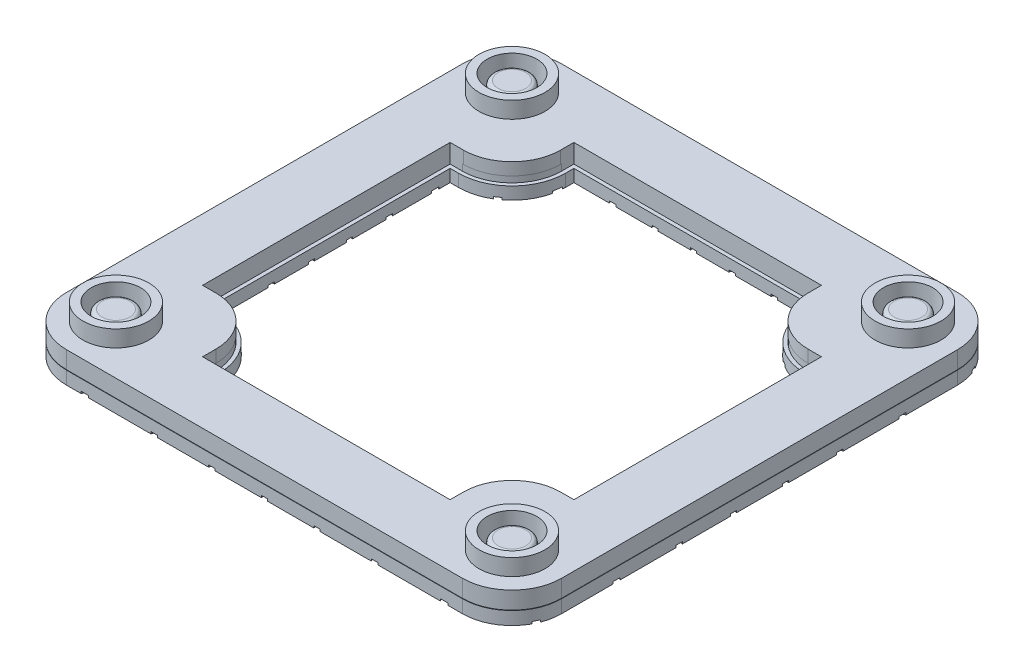
from build123d import *

# Parameters (mm, degrees)
SKETCH1_W                 = 240
SKETCH1_H                 = 240
BOSS_EXTRUDE1_DEPTH       = 12
FILLET2_R                 = 24
SKETCH3_4_R               = 8.7
BOSS_EXTRUDE2_DEPTH       = 5
CUT_EXTRUDE2_START        = -6
SKETCH3_R                 = 12
SKETCH3_R_2               = 8.7
CUT_EXTRUDE2_DEPTH        = 6
SKETCH4_W                 = 120
SKETCH4_H                 = 120
SKETCH4_H_2               = 60
SKETCH4_W_2               = 60
CUT_EXTRUDE3_DEPTH        = 6
FILLET6_R                 = 24
CUT_EXTRUDE4_DEPTH        = 6
SKETCH6_W                 = 120
SKETCH6_H                 = 180
CUT_EXTRUDE5_DEPTH        = 10
SKETCH8_W                 = 180
SKETCH8_H                 = 120
CUT_EXTRUDE6_DEPTH        = 20
FILLET7_R                 = 23.5
BOSS_EXTRUDE4_DEPTH       = 6
BOSS_EXTRUDE5_DEPTH       = 6
BOSS_EXTRUDE6_DEPTH       = 6
BOSS_EXTRUDE7_DEPTH       = 6
FILLET8_R                 = 2
SKETCH16_R                = 16
SKETCH16_R_2              = 12
BOSS_EXTRUDE10_DEPTH      = 8
SKETCH17_R                = 16
SKETCH17_R_2              = 12
BOSS_EXTRUDE11_DEPTH      = 8
SKETCH18_R                = 16
SKETCH18_R_2              = 12
BOSS_EXTRUDE12_DEPTH      = 8
BOSS_EXTRUDE13_DEPTH      = 0.0001
BOSS_EXTRUDE13_DEPTH_BACK = 6
SKETCH19_W                = 168
SKETCH19_H                = 30
SKETCH19_W_2              = 30
SKETCH19_H_2              = 168
CUT_EXTRUDE8_DEPTH        = 10
CUT_EXTRUDE8_DEPTH_BACK   = 0.1
SKETCH20_W                = 322.983229366
SKETCH20_H                = 303.266229899
BOSS_EXTRUDE14_DEPTH      = 3
BOSS_EXTRUDE15_DEPTH      = 3
CUT_EXTRUDE10_START       = -1
SKETCH24_W                = 3
SKETCH24_H                = 32
CUT_EXTRUDE10_DEPTH       = 1
CHAMFER1_SIZE             = 3.5
BOSS_EXTRUDE17_START      = 3.3
BOSS_EXTRUDE17_DEPTH      = 3.3
CHAMFER2_SIZE             = 3.2


with BuildPart() as part:
    # Sketch1 → Boss-Extrude1 (new body)
    with BuildSketch(Plane(origin=(0, 0, 0), x_dir=(1, 0, 0), z_dir=(0, 1, 0))):
        with Locations((120, 120)):
            Rectangle(SKETCH1_W, SKETCH1_H)
    extrude(amount=BOSS_EXTRUDE1_DEPTH)

    # Fillet2
    fillet2_edges = [part.edges().sort_by_distance(p)[0] for p in [
        (0, 6, -240),
        (240, 6, -240),
        (240, 6, 0),
        (0, 6, 0),
    ]]
    fillet(fillet2_edges, radius=FILLET2_R)

    # Sketch3<4> → Boss-Extrude2 (add)
    with BuildSketch(Plane(origin=(0, 12, 0), x_dir=(1, 0, 0), z_dir=(0, 1, 0))):
        with Locations(Location((24, 216, 0), (0, 0, 90))):
            Circle(SKETCH3_4_R)
        with Locations(Location((216, 216, 0), (0, 0, 90))):
            Circle(SKETCH3_4_R)
        with Locations(Location((216, 24, 0), (0, 0, 90))):
            Circle(SKETCH3_4_R)
        with Locations(Location((24, 24, 0), (0, 0, 90))):
            Circle(SKETCH3_4_R)
    extrude(amount=BOSS_EXTRUDE2_DEPTH)

    # Sketch3 → Cut-Extrude2 (cut)
    # profile 1 of 4: a face of its own
    with BuildSketch(Plane(origin=(0, 12, 0), x_dir=(1, 0, 0), z_dir=(0, 1, 0)).offset(CUT_EXTRUDE2_START)):
        with Locations(Location((24, 24, 0), (0, 0, 270))):
            Circle(SKETCH3_R)
        with Locations(Location((24, 24, 0), (0, 0, 270))):
            Circle(SKETCH3_R_2, mode=Mode.SUBTRACT)
    # profile 2 of 4: a face of its own
    with BuildSketch(Plane(origin=(0, 12, 0), x_dir=(1, 0, 0), z_dir=(0, 1, 0)).offset(CUT_EXTRUDE2_START)):
        with Locations(Location((216, 24, 0), (0, 0, 270))):
            Circle(SKETCH3_R)
        with Locations(Location((216, 24, 0), (0, 0, 270))):
            Circle(SKETCH3_R_2, mode=Mode.SUBTRACT)
    # profile 3 of 4: a face of its own
    with BuildSketch(Plane(origin=(0, 12, 0), x_dir=(1, 0, 0), z_dir=(0, 1, 0)).offset(CUT_EXTRUDE2_START)):
        with Locations(Location((216, 216, 0), (0, 0, 270))):
            Circle(SKETCH3_R)
        with Locations(Location((216, 216, 0), (0, 0, 270))):
            Circle(SKETCH3_R_2, mode=Mode.SUBTRACT)
    # profile 4 of 4: a face of its own
    with BuildSketch(Plane(origin=(0, 12, 0), x_dir=(1, 0, 0), z_dir=(0, 1, 0)).offset(CUT_EXTRUDE2_START)):
        with Locations(Location((24, 216, 0), (0, 0, 270))):
            Circle(SKETCH3_R)
        with Locations(Location((24, 216, 0), (0, 0, 270))):
            Circle(SKETCH3_R_2, mode=Mode.SUBTRACT)
    extrude(amount=CUT_EXTRUDE2_DEPTH, mode=Mode.SUBTRACT)

    # Sketch4 → Cut-Extrude3 (cut)
    with BuildSketch(Plane.XZ):
        with Locations((120, -120)):
            Rectangle(SKETCH4_W, SKETCH4_H)
        with Locations((120, -210)):
            Rectangle(SKETCH4_W, SKETCH4_H_2)
        with Locations((30, -120)):
            Rectangle(SKETCH4_W_2, SKETCH4_H)
        with Locations((120, -30)):
            Rectangle(SKETCH4_W, SKETCH4_H_2)
        with Locations((210, -120)):
            Rectangle(SKETCH4_W_2, SKETCH4_H)
    extrude(amount=-CUT_EXTRUDE3_DEPTH, mode=Mode.SUBTRACT)

    # Fillet6
    fillet6_edges = [part.edges().sort_by_distance(p)[0] for p in [
        (180, 3, -60),
        (240, 3, -60),
        (240, 3, -180),
        (180, 3, -180),
        (180, 3, -240),
        (60, 3, -240),
        (60, 3, -180),
        (0, 3, -180),
        (0, 3, -60),
        (60, 3, -60),
        (60, 3, 0),
        (180, 3, 0),
    ]]
    fillet(fillet6_edges, radius=FILLET6_R)

    # Sketch5 → Cut-Extrude4 (cut)
    with BuildSketch(Plane(origin=(0, 6, 0), x_dir=(-1, 0, 0), z_dir=(0, -1, 0))):
        Polygon((-180, 30), (-60, 30), (-120, 80), align=None)
        Polygon((-60, 210), (-120, 160), (-180, 210), align=None)
        Polygon((-210, 120), (-160, 120), (-210, 180), align=None)
        Polygon((-210, 60), (-160, 120), (-210, 120), align=None)
        Polygon((-80, 120), (-30, 60), (-30, 120), align=None)
        Polygon((-80, 120), (-30, 120), (-30, 180), align=None)
        with BuildLine():
            ThreePointArc((-145, 120), (-120, 95), (-95, 120))
            Line((-95, 120), (-145, 120))
        make_face()
        with BuildLine():
            Line((-145, 120), (-95, 120))
            ThreePointArc((-95, 120), (-120, 145), (-145, 120))
        make_face()
    extrude(amount=-CUT_EXTRUDE4_DEPTH, mode=Mode.SUBTRACT)

    # Sketch6 → Cut-Extrude5 (cut)
    with BuildSketch(Plane(origin=(0, 12, 0), x_dir=(1, 0, 0), z_dir=(0, 1, 0))):
        with Locations((120, 120)):
            Rectangle(SKETCH6_W, SKETCH6_H)
    extrude(amount=-CUT_EXTRUDE5_DEPTH, mode=Mode.SUBTRACT)

    # Sketch8 → Cut-Extrude6 (cut)
    with BuildSketch(Plane(origin=(0, 12, 0), x_dir=(1, 0, 0), z_dir=(0, 1, 0))):
        with Locations((120, 120)):
            Rectangle(SKETCH8_W, SKETCH8_H)
    extrude(amount=-CUT_EXTRUDE6_DEPTH, mode=Mode.SUBTRACT)

    # Fillet7
    fillet7_edges = [part.edges().sort_by_distance(p)[0] for p in [
        (60, 9, -180),
        (180, 9, -180),
        (60, 9, -60),
        (180, 9, -60),
    ]]
    fillet(fillet7_edges, radius=FILLET7_R)

    # Sketch9 → Boss-Extrude4 (add)
    with BuildSketch(Plane.XZ.offset(-6)):
        with BuildLine():
            Line((146.986153835, -210), (96.986153835, -210))
            ThreePointArc((96.986153835, -210), (81.986153835, -225), (96.986153835, -240))
            Line((96.986153835, -240), (146.986153835, -240))
            ThreePointArc((146.986153835, -240), (161.986153835, -225), (146.986153835, -210))
        make_face()
    extrude(amount=BOSS_EXTRUDE4_DEPTH)

    # Sketch10 → Boss-Extrude5 (add)
    with BuildSketch(Plane.XZ.offset(-6)):
        with BuildLine():
            ThreePointArc((240, -95), (225, -80), (210, -95))
            Line((210, -95), (210, -145))
            ThreePointArc((210, -145), (225, -160), (240, -145))
            Line((240, -145), (240, -95))
        make_face()
    extrude(amount=BOSS_EXTRUDE5_DEPTH)

    # Sketch11 → Boss-Extrude6 (add)
    with BuildSketch(Plane.XZ.offset(-6)):
        with BuildLine():
            Line((145, 0), (95, 0))
            ThreePointArc((95, 0), (80, -15), (95, -30))
            Line((95, -30), (145, -30))
            ThreePointArc((145, -30), (160, -15), (145, 0))
        make_face()
    extrude(amount=BOSS_EXTRUDE6_DEPTH)

    # Sketch12 → Boss-Extrude7 (add)
    with BuildSketch(Plane.XZ.offset(-6)):
        with BuildLine():
            ThreePointArc((30, -95), (15, -80), (0, -95))
            Line((0, -95), (0, -145))
            ThreePointArc((0, -145), (15, -160), (30, -145))
            Line((30, -145), (30, -95))
        make_face()
    extrude(amount=BOSS_EXTRUDE7_DEPTH)

    # Fillet8
    fillet8_edges = [part.edges().sort_by_distance(p)[0] for p in [
        (24, 17, -207.3),
        (216, 17, -207.3),
        (216, 17, -15.3),
        (24, 17, -15.3),
    ]]
    fillet(fillet8_edges, radius=FILLET8_R)

    # Sketch16 → Boss-Extrude10 (add)
    with BuildSketch(Plane(origin=(0, 12, 0), x_dir=(1, 0, 0), z_dir=(0, 1, 0))):
        with Locations(Location((24, 216, 0), (0, 0, 90))):
            Circle(SKETCH16_R)
        with Locations(Location((24, 216, 0), (0, 0, 270))):
            Circle(SKETCH16_R_2, mode=Mode.SUBTRACT)
    extrude(amount=BOSS_EXTRUDE10_DEPTH)

    # Sketch17 → Boss-Extrude11 (add)
    with BuildSketch(Plane(origin=(0, 12, 0), x_dir=(1, 0, 0), z_dir=(0, 1, 0))):
        with Locations(Location((24, 24, 0), (0, 0, 90))):
            Circle(SKETCH17_R)
        with Locations(Location((24, 24, 0), (0, 0, 270))):
            Circle(SKETCH17_R_2, mode=Mode.SUBTRACT)
    extrude(amount=BOSS_EXTRUDE11_DEPTH)

    # Sketch18 → Boss-Extrude12 (add)
    # profile 1 of 2: a face of its own
    with BuildSketch(Plane(origin=(0, 12, 0), x_dir=(1, 0, 0), z_dir=(0, 1, 0))):
        with Locations(Location((216, 24, 0), (0, 0, 90))):
            Circle(SKETCH18_R)
        with Locations(Location((216, 24, 0), (0, 0, 270))):
            Circle(SKETCH18_R_2, mode=Mode.SUBTRACT)
    # profile 2 of 2: a face of its own
    with BuildSketch(Plane(origin=(0, 12, 0), x_dir=(1, 0, 0), z_dir=(0, 1, 0))):
        with Locations(Location((216, 216, 0), (0, 0, 90))):
            Circle(SKETCH18_R)
        with Locations(Location((216, 216, 0), (0, 0, 270))):
            Circle(SKETCH18_R_2, mode=Mode.SUBTRACT)
    extrude(amount=BOSS_EXTRUDE12_DEPTH)

    # Sketch19 → Boss-Extrude13 (add, two sides: drawn at the far end of the back side and taken through both)
    with BuildSketch(Plane.XZ.offset(-BOSS_EXTRUDE13_DEPTH_BACK)):
        with Locations((120, -15)):
            Rectangle(SKETCH19_W, SKETCH19_H)
        with Locations((15, -120)):
            Rectangle(SKETCH19_W_2, SKETCH19_H_2)
        with Locations((120, -225)):
            Rectangle(SKETCH19_W, SKETCH19_H)
        with Locations((225, -120)):
            Rectangle(SKETCH19_W_2, SKETCH19_H_2)
    extrude(amount=BOSS_EXTRUDE13_DEPTH + BOSS_EXTRUDE13_DEPTH_BACK)

    # Sketch20 → Cut-Extrude8 (cut, two sides: drawn at the far end of the back side and taken through both)
    with BuildSketch(Plane.XZ.offset(-CUT_EXTRUDE8_DEPTH_BACK)):
        with Locations((114.836023949, -113.897119213)):
            Rectangle(SKETCH20_W, SKETCH20_H)
    extrude(amount=CUT_EXTRUDE8_DEPTH + CUT_EXTRUDE8_DEPTH_BACK, mode=Mode.SUBTRACT)

    # Chamfer1
    chamfer1_edges = [part.edges().sort_by_distance(p)[0] for p in [
        (121.986153835, 0.1, -240),
        (0, 0.1, -120),
        (120, 0.1, 0),
        (240, 0.1, -120),
        (232.970562748, 0.1, -232.970562748),
        (232.970562748, 0.1, -7.029437252),
        (7.029437252, 0.1, -7.029437252),
        (7.029437252, 0.1, -232.970562748),
    ]]
    chamfer(chamfer1_edges, length=CHAMFER1_SIZE)


with BuildPart() as body_2:
    # Sketch21 → Boss-Extrude14 (new body)
    with BuildSketch(Plane.XZ.offset(-0.1)):
        with BuildLine():
            Line((240, -216), (240, -24))
            ThreePointArc((240, -24), (232.970562748, -7.029437252), (216, 0))
            Line((216, 0), (24, 0))
            ThreePointArc((24, 0), (7.029437252, -7.029437252), (0, -24))
            Line((0, -24), (0, -216))
            ThreePointArc((0, -216), (7.029437252, -232.970562748), (24, -240))
            Line((24, -240), (216, -240))
            ThreePointArc((216, -240), (232.970562748, -232.970562748), (240, -216))
        make_face()
        with BuildLine():
            Line((62, -32), (62, -36))
            ThreePointArc((62, -36), (54.384776311, -54.384776311), (36, -62))
            Line((36, -62), (32, -62))
            Line((32, -62), (32, -178))
            Line((32, -178), (36, -178))
            ThreePointArc((36, -178), (54.384776311, -185.615223689), (62, -204))
            Line((62, -204), (62, -208))
            Line((62, -208), (178, -208))
            Line((178, -208), (178, -204))
            ThreePointArc((178, -204), (185.615223689, -185.615223689), (204, -178))
            Line((204, -178), (208, -178))
            Line((208, -178), (208, -62))
            Line((208, -62), (204, -62))
            ThreePointArc((204, -62), (185.615223689, -54.384776311), (178, -36))
            Line((178, -36), (178, -32))
            Line((178, -32), (62, -32))
        make_face(mode=Mode.SUBTRACT)
    extrude(amount=BOSS_EXTRUDE14_DEPTH)

    # Sketch23 → Boss-Extrude15 (add)
    with BuildSketch(Plane(origin=(0, 0.1, 0), x_dir=(1, 0, 0), z_dir=(0, 1, 0))):
        with BuildLine():
            Line((30.2, 179.8), (30.2, 60.2))
            Line((30.2, 60.2), (36, 60.2))
            ThreePointArc((36, 60.2), (53.111984105, 53.111984105), (60.2, 36))
            Line((60.2, 36), (60.2, 30.2))
            Line((60.2, 30.2), (179.8, 30.2))
            Line((179.8, 30.2), (179.8, 36))
            ThreePointArc((179.8, 36), (186.888015895, 53.111984105), (204, 60.2))
            Line((204, 60.2), (209.8, 60.2))
            Line((209.8, 60.2), (209.8, 179.8))
            Line((209.8, 179.8), (204, 179.8))
            ThreePointArc((204, 179.8), (186.888015895, 186.888015895), (179.8, 204))
            Line((179.8, 204), (179.8, 209.8))
            Line((179.8, 209.8), (60.2, 209.8))
            Line((60.2, 209.8), (60.2, 204))
            ThreePointArc((60.2, 204), (53.111984105, 186.888015895), (36, 179.8))
            Line((36, 179.8), (30.2, 179.8))
        make_face()
        with BuildLine():
            Line((32, 62), (36, 62))
            ThreePointArc((36, 62), (54.384776311, 54.384776311), (62, 36))
            Line((62, 36), (62, 32))
            Line((62, 32), (178, 32))
            Line((178, 32), (178, 36))
            ThreePointArc((178, 36), (185.615223689, 54.384776311), (204, 62))
            Line((204, 62), (208, 62))
            Line((208, 62), (208, 178))
            Line((208, 178), (204, 178))
            ThreePointArc((204, 178), (185.615223689, 185.615223689), (178, 204))
            Line((178, 204), (178, 208))
            Line((178, 208), (62, 208))
            Line((62, 208), (62, 204))
            ThreePointArc((62, 204), (54.384776311, 185.615223689), (36, 178))
            Line((36, 178), (32, 178))
            Line((32, 178), (32, 62))
        make_face(mode=Mode.SUBTRACT)
    extrude(amount=BOSS_EXTRUDE15_DEPTH)

    # Sketch24 → Cut-Extrude10 (cut)
    with BuildSketch(Plane.XZ.offset(2.9).offset(CUT_EXTRUDE10_START)):
        Polygon((32, -169.074772881), (32, -172.538874496), (0, -191.01408311), (0, -187.549981495), align=None)
        Polygon((171.785487819, 0), (157.538169889, -32), (160.822078725, -32), (175.069396655, 0), align=None)
        with Locations((120, -16)):
            Rectangle(SKETCH24_W, SKETCH24_H)
        with BuildLine():
            Line((237.092923891, -12.550608675), (188.155322359, -56.614223013))
            ThreePointArc((188.155322359, -56.614223013), (189.408267479, -57.519324851), (190.712781872, -58.348374313))
            Line((190.712781872, -58.348374313), (238.407670379, -15.403703809))
            ThreePointArc((238.407670379, -15.403703809), (237.797028775, -13.955621643), (237.092923891, -12.550608675))
        make_face()
        Polygon((240, -79.432443116), (208, -89.829873395), (208, -92.984260068), (240, -82.586829788), align=None)
        Polygon((240, -131.104245812), (208, -127.740910284), (208, -130.757435123), (240, -134.120770651), align=None)
        Polygon((240, -187.549981495), (208, -169.074772881), (208, -172.538874496), (240, -191.01408311), align=None)
        with BuildLine():
            Line((209.039205327, -240), (178.658666771, -198.184775998))
            ThreePointArc((178.658666771, -198.184775998), (178.264223021, -200.302732999), (178.046477754, -202.446074953))
            Line((178.046477754, -202.446074953), (205.331001394, -240))
            Line((205.331001394, -240), (209.039205327, -240))
        make_face()
        Polygon((147.040298293, -240), (140.238488319, -208), (137.171466535, -208), (143.973276508, -240), align=None)
        Polygon((96.026723492, -240), (102.828533465, -208), (99.761511681, -208), (92.959701707, -240), align=None)
        with BuildLine():
            Line((34.668998606, -240), (61.953522246, -202.446074953))
            ThreePointArc((61.953522246, -202.446074953), (61.735776979, -200.302733), (61.341333229, -198.184775998))
            Line((61.341333229, -198.184775998), (30.960794673, -240))
            Line((30.960794673, -240), (34.668998606, -240))
        make_face()
        Polygon((0, -134.120770651), (32, -130.757435123), (32, -127.740910284), (0, -131.104245813), align=None)
        Polygon((0, -82.586829788), (32, -92.984260068), (32, -89.829873395), (0, -79.432443116), align=None)
        with BuildLine():
            Line((1.592329621, -15.403703809), (49.287218128, -58.348374313))
            ThreePointArc((49.287218128, -58.348374313), (50.591732521, -57.519324851), (51.844677641, -56.614223013))
            Line((51.844677641, -56.614223013), (2.907076109, -12.550608675))
            ThreePointArc((2.907076109, -12.550608675), (2.202971225, -13.955621643), (1.592329621, -15.403703809))
        make_face()
        Polygon((64.930603345, 0), (79.177921275, -32), (82.461830111, -32), (68.214512181, 0), align=None)
        with BuildLine():
            Line((190.712781872, -181.651625687), (238.407670379, -224.596296191))
            ThreePointArc((238.407670379, -224.596296191), (237.797028775, -226.044378357), (237.092923891, -227.449391325))
            Line((237.092923891, -227.449391325), (188.155322359, -183.385776987))
            ThreePointArc((188.155322359, -183.385776987), (189.408267479, -182.480675149), (190.712781872, -181.651625687))
        make_face()
        Polygon((0, -157.413170212), (0, -160.567556884), (32, -150.170126605), (32, -147.015739932), align=None)
        with BuildLine():
            Line((209.039205327, 0), (205.331001394, 0))
            Line((205.331001394, 0), (178.046477754, -37.553925047))
            ThreePointArc((178.046477754, -37.553925047), (178.264223021, -39.697267001), (178.658666771, -41.815224002))
            Line((178.658666771, -41.815224002), (209.039205327, 0))
        make_face()
        Polygon((0, -48.98591689), (0, -52.450018505), (32, -70.925227119), (32, -67.461125504), align=None)
        Polygon((79.177921275, -208), (82.461830111, -208), (68.214512181, -240), (64.930603345, -240), align=None)
        Polygon((160.822078725, -208), (175.069396655, -240), (171.785487819, -240), (157.538169889, -208), align=None)
        with Locations((120, -224)):
            Rectangle(SKETCH24_W, SKETCH24_H)
        with BuildLine():
            Line((51.844677641, -183.385776987), (2.907076109, -227.449391325))
            ThreePointArc((2.907076109, -227.449391325), (2.202971225, -226.044378357), (1.592329621, -224.596296191))
            Line((1.592329621, -224.596296191), (49.287218128, -181.651625687))
            ThreePointArc((49.287218128, -181.651625687), (50.591732521, -182.480675149), (51.844677641, -183.385776987))
        make_face()
        Polygon((32, -112.259089716), (0, -108.895754187), (0, -105.879229349), (32, -109.242564877), align=None)
        Polygon((208, -150.170126605), (208, -147.015739932), (240, -157.413170212), (240, -160.567556884), align=None)
        with BuildLine():
            Line((61.341333229, -41.815224002), (30.960794673, 0))
            Line((30.960794673, 0), (34.668998606, 0))
            Line((34.668998606, 0), (61.953522246, -37.553925047))
            ThreePointArc((61.953522246, -37.553925047), (61.735776979, -39.697267), (61.341333229, -41.815224002))
        make_face()
        Polygon((208, -112.259089716), (208, -109.242564877), (240, -105.879229349), (240, -108.895754188), align=None)
        Polygon((99.761511681, -32), (92.959701707, 0), (96.026723492, 0), (102.828533465, -32), align=None)
        Polygon((240, -52.450018505), (240, -48.98591689), (208, -67.461125504), (208, -70.925227119), align=None)
        Polygon((137.171466535, -32), (143.973276508, 0), (147.040298293, 0), (140.238488319, -32), align=None)
    extrude(amount=CUT_EXTRUDE10_DEPTH, mode=Mode.SUBTRACT)

    # Sketch27 → Boss-Extrude17 (add)
    with BuildSketch(Plane(origin=(0, 0.1, 0), x_dir=(1, 0, 0), z_dir=(0, 1, 0)).offset(BOSS_EXTRUDE17_START)):
        with BuildLine():
            Line((216, 240), (24, 240))
            ThreePointArc((24, 240), (7.029437252, 232.970562748), (0, 216))
            Line((0, 216), (0, 24))
            ThreePointArc((0, 24), (7.029437252, 7.029437252), (24, 0))
            Line((24, 0), (216, 0))
            ThreePointArc((216, 0), (232.970562748, 7.029437252), (240, 24))
            Line((240, 24), (240, 216))
            ThreePointArc((240, 216), (232.970562748, 232.970562748), (216, 240))
        make_face()
        with BuildLine():
            Line((3.3, 216), (3.3, 24))
            ThreePointArc((3.3, 24), (9.362889629, 9.362889629), (24, 3.3))
            Line((24, 3.3), (216, 3.3))
            ThreePointArc((216, 3.3), (230.637110371, 9.362889629), (236.7, 24))
            Line((236.7, 24), (236.7, 216))
            ThreePointArc((236.7, 216), (230.637110371, 230.637110371), (216, 236.7))
            Line((216, 236.7), (24, 236.7))
            ThreePointArc((24, 236.7), (9.362889629, 230.637110371), (3.3, 216))
        make_face(mode=Mode.SUBTRACT)
    extrude(amount=-BOSS_EXTRUDE17_DEPTH)

    # Chamfer2
    chamfer2_edges = [body_2.edges().sort_by_distance(p)[0] for p in [
        (9.362889629, 3.4, -230.637110371),
        (3.3, 3.4, -120),
        (9.362889629, 3.4, -9.362889629),
        (120, 3.4, -3.3),
        (230.637110371, 3.4, -9.362889629),
        (236.7, 3.4, -120),
        (230.637110371, 3.4, -230.637110371),
        (120, 3.4, -236.7),
    ]]
    chamfer(chamfer2_edges, length=CHAMFER2_SIZE)


solid = Compound([part.part, body_2.part])
